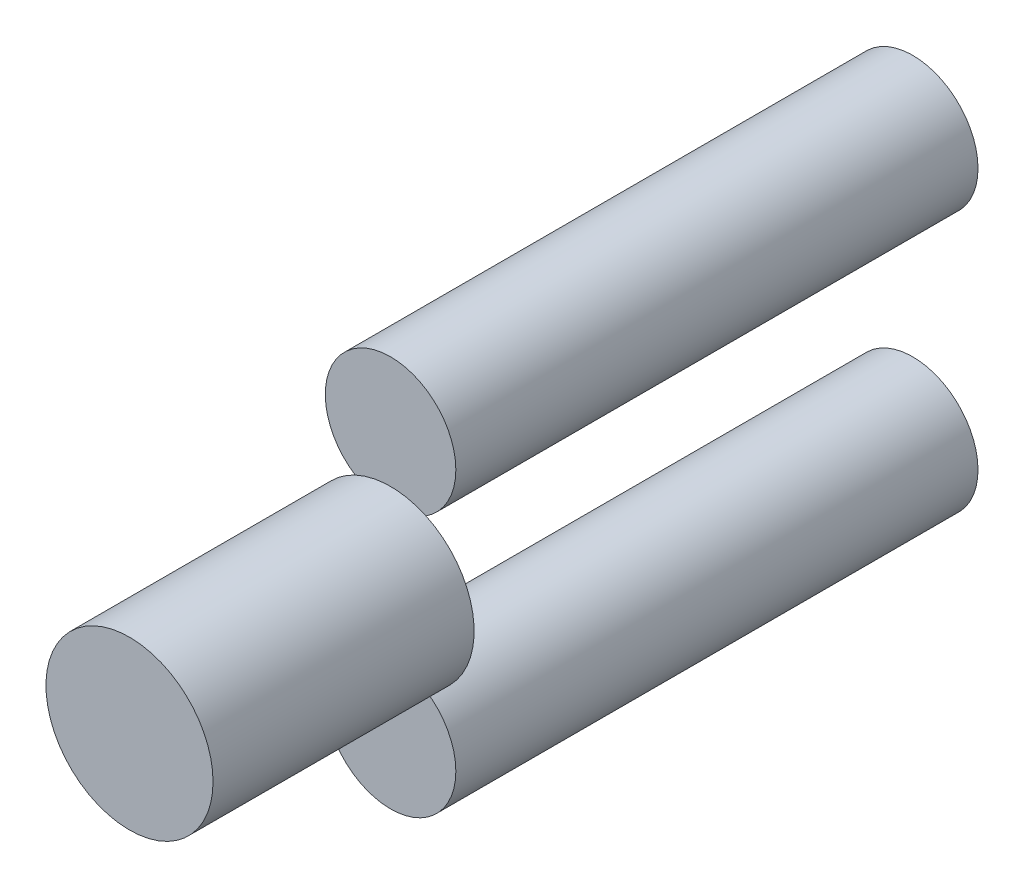
from build123d import *

# Parameters (mm, degrees)
SKETCH1_R             = 1.5875
BOSS_EXTRUDE1_DEPTH   = 12.7
BOSS_EXTRUDE1_2_DEPTH = 12.7
SKETCH2_R             = 2.032
BOSS_EXTRUDE2_DEPTH   = 6.35


with BuildPart() as part:
    # Sketch1 → Boss-Extrude1 (new body)
    with BuildSketch(Plane.XY):
        with Locations((0, 12.7)):
            Circle(SKETCH1_R)
    extrude(amount=-BOSS_EXTRUDE1_DEPTH)



with BuildPart() as body_2:
    # Sketch1 → Boss-Extrude1 2 (new body)
    with BuildSketch(Plane.XY):
        with Locations((0, 19.05)):
            Circle(SKETCH1_R)
    extrude(amount=-BOSS_EXTRUDE1_2_DEPTH)


with BuildPart() as part_1:
    add(part.part)

    add(body_2.part)  # Boss-Extrude2 merges body 2
    # Sketch2 → Boss-Extrude2 (add)
    with BuildSketch(Plane.XY):
        with Locations(Location((0, 15.875, 0), (0, 0, 115.050153991))):
            Circle(SKETCH2_R)
    extrude(amount=BOSS_EXTRUDE2_DEPTH)


solid = part_1.part
